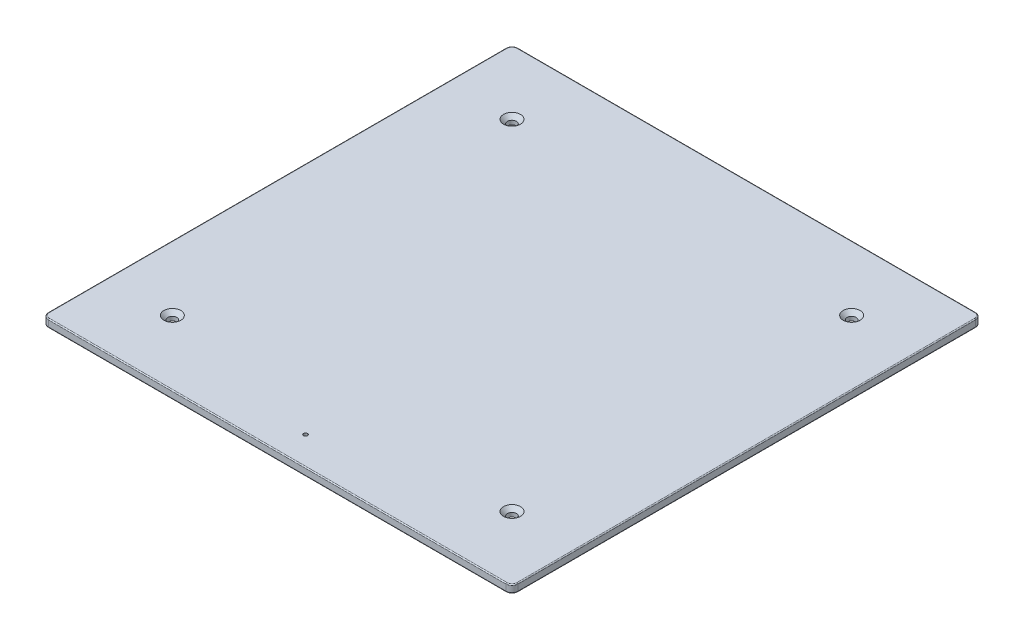
from build123d import *

# Parameters (mm, degrees)
SKETCH1_W           = 235
SKETCH1_H           = 235
SKETCH1_R           = 2.25
BOSS_EXTRUDE1_DEPTH = 4
CHAMFER1_SIZE       = 2
FILLET1_R           = 3
FILLET2_R           = 0.5
SKETCH2_R           = 1
CUT_EXTRUDE1_DEPTH  = 4


with BuildPart() as part:
    # Sketch1 → Boss-Extrude1 (new body)
    with BuildSketch(Plane(origin=(0, 0, 0), x_dir=(1, 0, 0), z_dir=(0, 1, 0))):
        Rectangle(SKETCH1_W, SKETCH1_H)
        with Locations(Location((85, 85, 0), (0, 0, 270))):
            Circle(SKETCH1_R, mode=Mode.SUBTRACT)
        with Locations(Location((-85, 85, 0), (0, 0, 270))):
            Circle(SKETCH1_R, mode=Mode.SUBTRACT)
        with Locations(Location((-85, -85, 0), (0, 0, 270))):
            Circle(SKETCH1_R, mode=Mode.SUBTRACT)
        with Locations(Location((85, -85, 0), (0, 0, 270))):
            Circle(SKETCH1_R, mode=Mode.SUBTRACT)
    extrude(amount=BOSS_EXTRUDE1_DEPTH)

    # Chamfer1
    chamfer1_edges = [part.edges().sort_by_distance(p)[0] for p in [
        (85, 4, -87.25),
        (-85, 4, -87.25),
        (-85, 4, 82.75),
        (85, 4, 82.75),
    ]]
    chamfer(chamfer1_edges, length=CHAMFER1_SIZE)

    # Fillet1
    fillet1_edges = [part.edges().sort_by_distance(p)[0] for p in [
        (117.5, 2, 117.5),
        (-117.5, 2, 117.5),
        (-117.5, 2, -117.5),
        (117.5, 2, -117.5),
    ]]
    fillet(fillet1_edges, radius=FILLET1_R)

    # Fillet2
    fillet2_edges = [part.edges().sort_by_distance(p)[0] for p in [
        (117.5, 0, 0),
        (117.5, 4, 0),
        (0, 0, 117.5),
        (-117.5, 0, 0),
        (0, 0, -117.5),
        (116.621320344, 0, -116.621320344),
        (-116.621320344, 0, -116.621320344),
        (-116.621320344, 0, 116.621320344),
        (116.621320344, 0, 116.621320344),
        (0, 4, 117.5),
        (0, 4, -117.5),
        (-117.5, 4, 0),
        (116.621320344, 4, -116.621320344),
        (-116.621320344, 4, -116.621320344),
        (-116.621320344, 4, 116.621320344),
        (116.621320344, 4, 116.621320344),
    ]]
    fillet(fillet2_edges, radius=FILLET2_R)

    # Sketch2 → Cut-Extrude1 (cut)
    with BuildSketch(Plane(origin=(0, 4, 0), x_dir=(1, 0, 0), z_dir=(0, 1, 0))):
        with Locations(Location((0, -103.332788309, 0), (0, 0, 270))):
            Circle(SKETCH2_R)
    extrude(amount=-CUT_EXTRUDE1_DEPTH, mode=Mode.SUBTRACT)


solid = part.part
